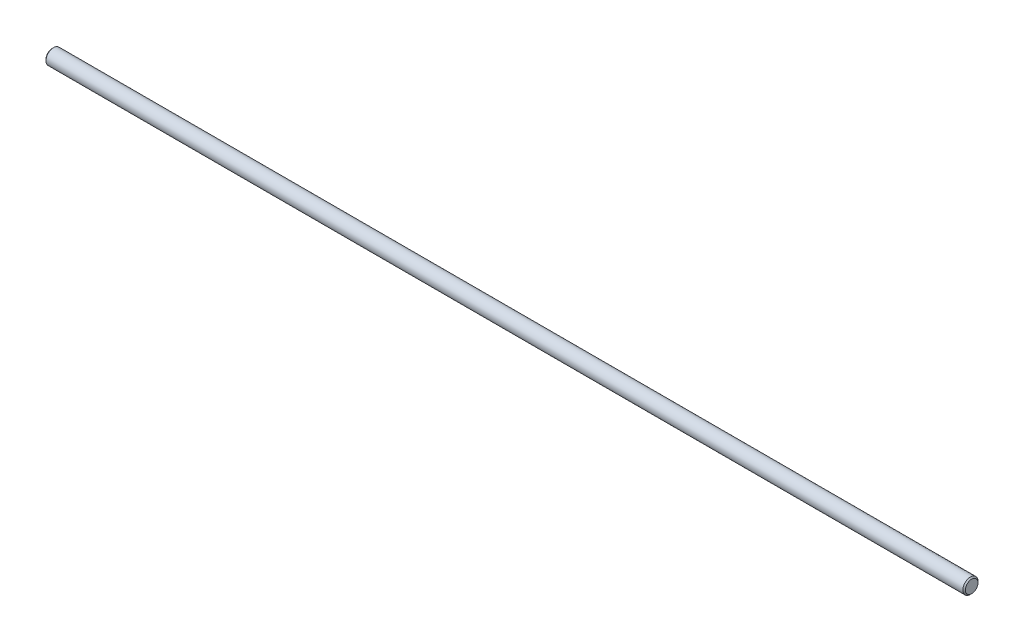
from build123d import *

# Parameters (mm, degrees)
SZKIC1_R                    = 3
DODANIE_WYCI_GNI_CIE1_DEPTH = 364
SFAZOWANIE1_SIZE            = 0.5


with BuildPart() as part:
    # Szkic1 → Dodanie-wyciągnięcie1 (new body)
    with BuildSketch(Plane(origin=(0, 0, 0), x_dir=(0, 0, -1), z_dir=(1, 0, 0))):
        with Locations((-47.4, 2.52)):
            Circle(SZKIC1_R)
    extrude(amount=-DODANIE_WYCI_GNI_CIE1_DEPTH)

    # Sfazowanie1
    sfazowanie1_edges = [part.edges().sort_by_distance(p)[0] for p in [
        (0, 2.52, 50.4),
        (-364, 2.52, 50.4),
    ]]
    chamfer(sfazowanie1_edges, length=SFAZOWANIE1_SIZE)


solid = part.part
